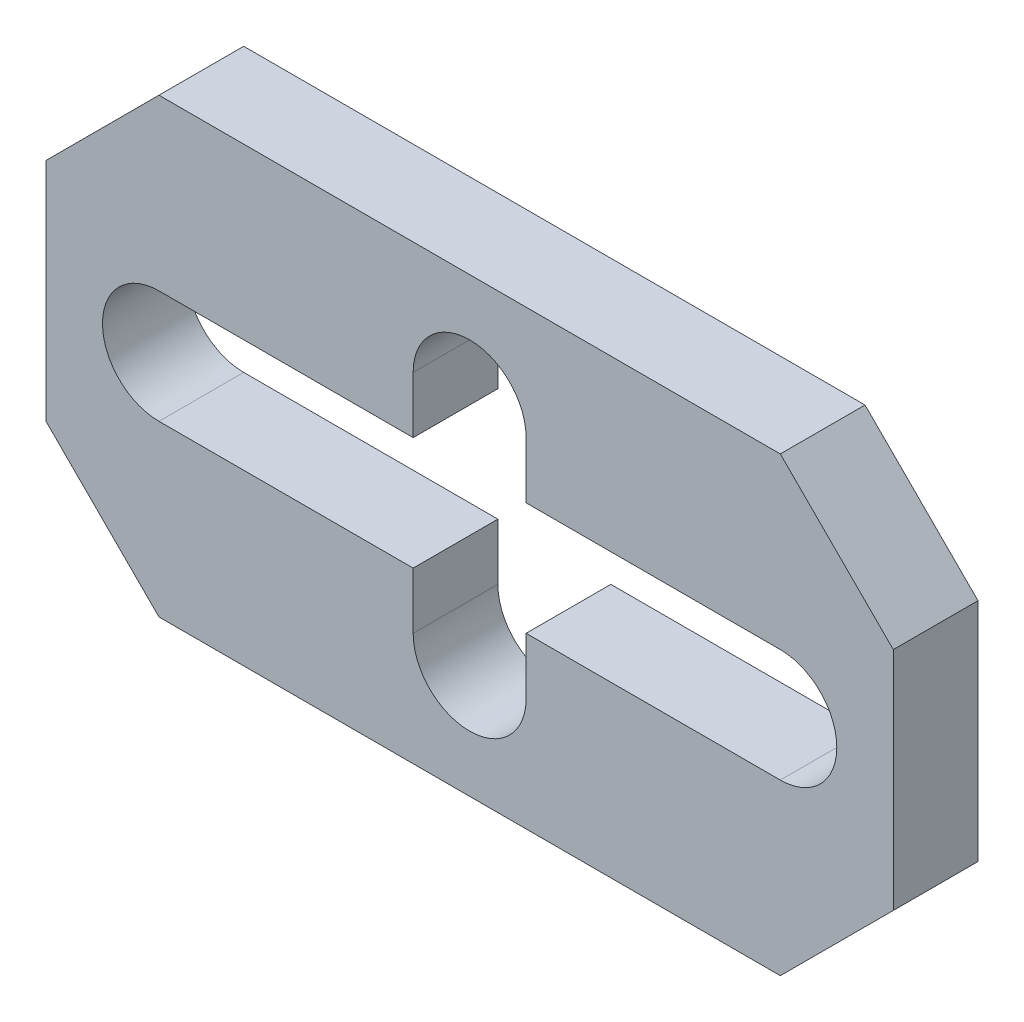
from build123d import *

# Parameters (mm, degrees)
BOSS_EXTRUDE1_DEPTH = 15


with BuildPart() as part:
    # Sketch1 → Boss-Extrude1 (new body)
    with BuildSketch(Plane.XY):
        Polygon((-75, 20), (-55, 40), (55, 40), (75, 20), (75, -20), (55, -40), (-55, -40), (-75, -20), align=None)
        with BuildLine():
            Line((-10, 10), (-10, 20))
            ThreePointArc((-10, 20), (0, 30), (10, 20))
            Line((10, 20), (10, 10))
            Line((10, 10), (55, 10))
            ThreePointArc((55, 10), (65, 0), (55, -10))
            Line((55, -10), (10, -10))
            Line((10, -10), (10, -20))
            ThreePointArc((10, -20), (0, -30), (-10, -20))
            Line((-10, -20), (-10, -10))
            Line((-10, -10), (-55, -10))
            ThreePointArc((-55, -10), (-65, 0), (-55, 10))
            Line((-55, 10), (-10, 10))
        make_face(mode=Mode.SUBTRACT)
    extrude(amount=BOSS_EXTRUDE1_DEPTH)


solid = part.part
